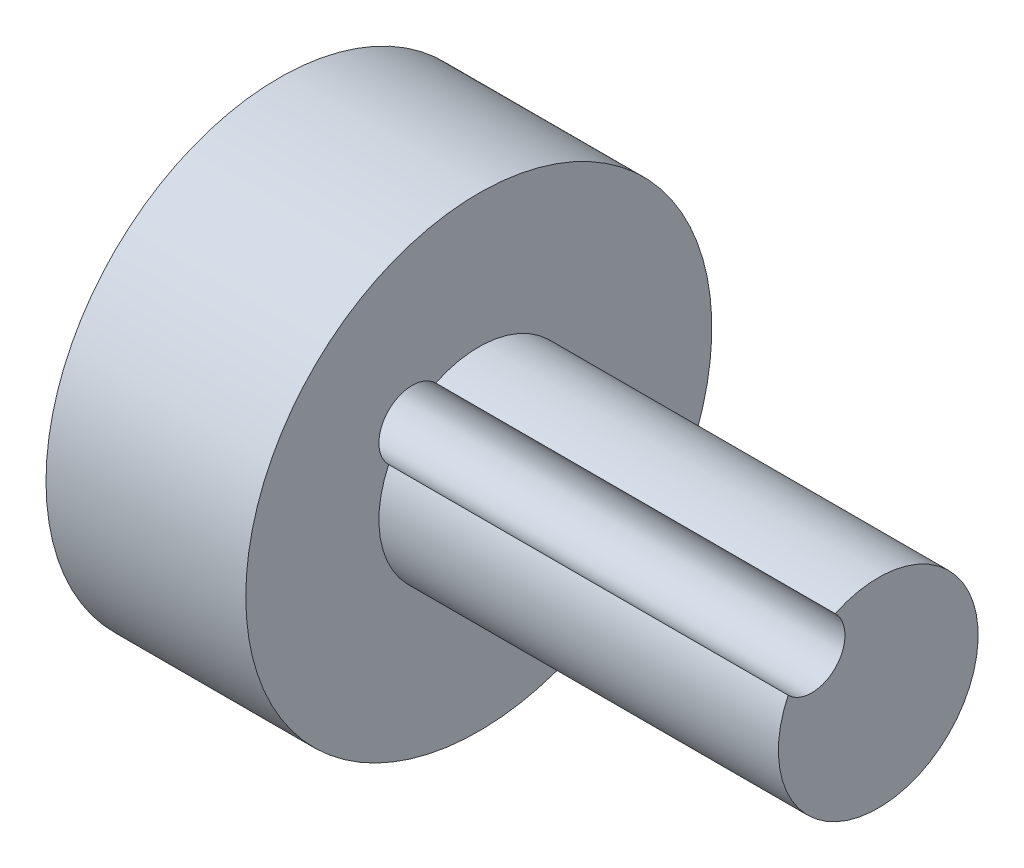
from build123d import *

# Parameters (mm, degrees)
SKETCH_2_R          = 5
CUT_EXTRUDE_1_DEPTH = 20
SKETCH_3_R          = 5
CUT_EXTRUDE_2_DEPTH = 112.579568022


with BuildPart() as part:
    # Эскиз1 → Повернуть1 (revolve)
    with BuildSketch(Plane.XY, mode=Mode.PRIVATE) as revolve_1_sk:
        Polygon((0, 0), (100, 0), (100, 15), (40, 15), (40, 35), (10, 35), (10, 20), (0, 20), align=None)
    revolve(revolve_1_sk.sketch.rotate(Axis((0, 0, 0), (1, 0, 0)), 90), axis=Axis((0, 0, 0), (1, 0, 0)))

    # Эскиз2 → Вырез-Вытянуть1 (cut)
    with BuildSketch(Plane(origin=(0, 0, 0), x_dir=(0, 0, -1), z_dir=(1, 0, 0))):
        with Locations((10, 10)):
            Circle(SKETCH_2_R)
    extrude(amount=CUT_EXTRUDE_1_DEPTH, mode=Mode.SUBTRACT)

    # Эскиз3 → Вырез-Вытянуть2 (cut, through all)
    with BuildSketch(Plane(origin=(0, 0, 0), x_dir=(0, 0, -1), z_dir=(1, 0, 0))):
        with Locations(Location((-10, 10, 0), (0, 0, 225))):
            Circle(SKETCH_3_R)
    extrude(amount=CUT_EXTRUDE_2_DEPTH, mode=Mode.SUBTRACT)


solid = part.part
